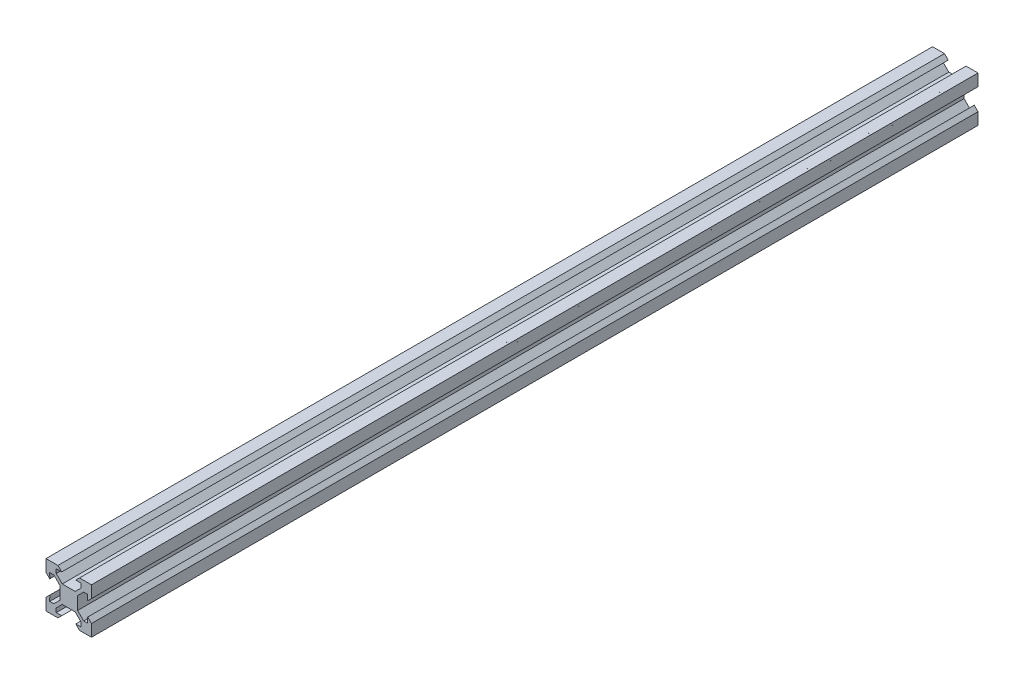
from build123d import *

# Parameters (mm, degrees)
BOSS_EXTRUDE1_DEPTH = 390


with BuildPart() as part:
    # Sketch1 → Boss-Extrude1 (new body)
    with BuildSketch(Plane.XY):
        Polygon((2.834320347, 3.893970342), (-2.834320347, 3.893970342), (-5.5, 6.558849663), (-5.5, 8.349069506), (-3.1, 8.349069506), (-4.75, 9.998574117), (-10, 9.998574117), (-10, 4.746997406), (-8.35, 3.097492795), (-8.350720674, 5.497492687), (-6.560500912, 5.498030255), (-3.894821259, 2.833150935), (-3.894821259, -2.833150935), (-6.560500912, -5.498030255), (-8.350720674, -5.497492687), (-8.35, -3.097492795), (-10, -4.746997406), (-10, -9.998574117), (-4.75, -9.998574117), (-3.1, -8.349069506), (-5.5, -8.349069506), (-5.5, -6.558849663), (-2.834320347, -3.893970342), (2.834320347, -3.893970342), (5.5, -6.558849663), (5.5, -8.349069506), (3.1, -8.349069506), (4.75, -9.998574117), (10, -9.998574117), (10, -4.746997406), (8.35, -3.097492795), (8.350720674, -5.497492687), (6.560500912, -5.498030255), (3.894821259, -2.833150935), (3.894821259, 2.833150935), (6.560500912, 5.498030255), (8.350720674, 5.497492687), (8.35, 3.097492795), (10, 4.746997406), (10, 9.998574117), (4.75, 9.998574117), (3.1, 8.349069506), (5.5, 8.349069506), (5.5, 6.558849663), align=None)
    extrude(amount=BOSS_EXTRUDE1_DEPTH)


solid = part.part
